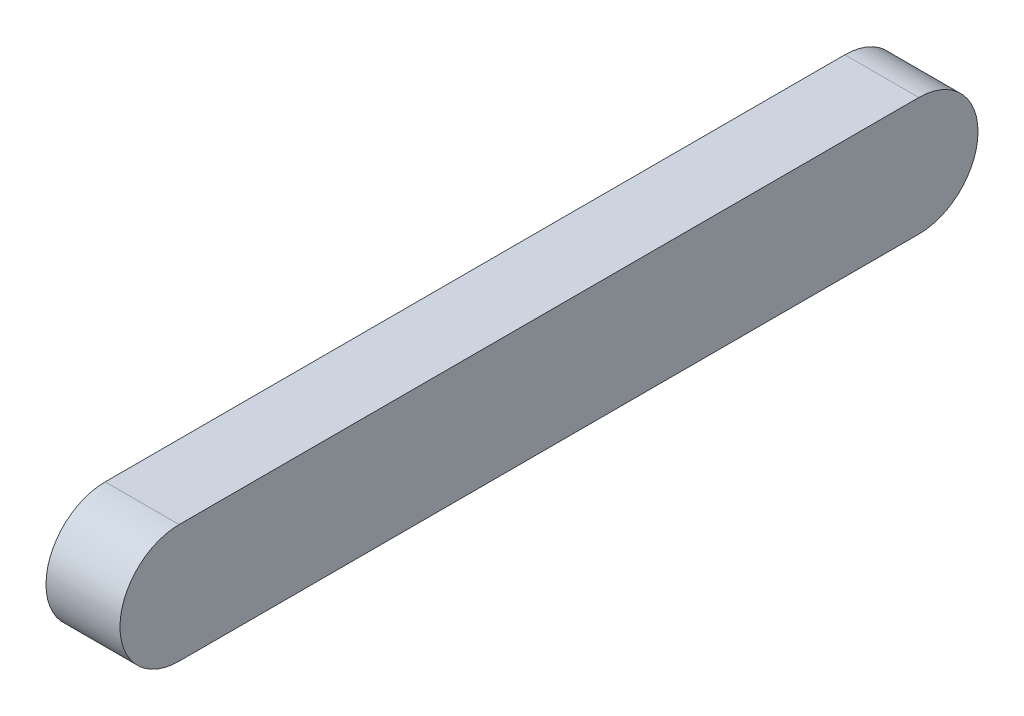
from build123d import *

# Parameters (mm, degrees)
BOSS_EXTRUDE1_DEPTH = 3.175


with BuildPart() as part:
    # Sketch1 → Boss-Extrude1 (new body)
    with BuildSketch(Plane(origin=(0, 0, 0), x_dir=(0, 0, -1), z_dir=(1, 0, 0))):
        with BuildLine():
            Line((-15.875, 2.54), (15.875, 2.54))
            ThreePointArc((15.875, 2.54), (18.415, 0), (15.875, -2.54))
            Line((15.875, -2.54), (-15.875, -2.54))
            ThreePointArc((-15.875, -2.54), (-18.415, 0), (-15.875, 2.54))
        make_face()
    extrude(amount=BOSS_EXTRUDE1_DEPTH)


solid = part.part
